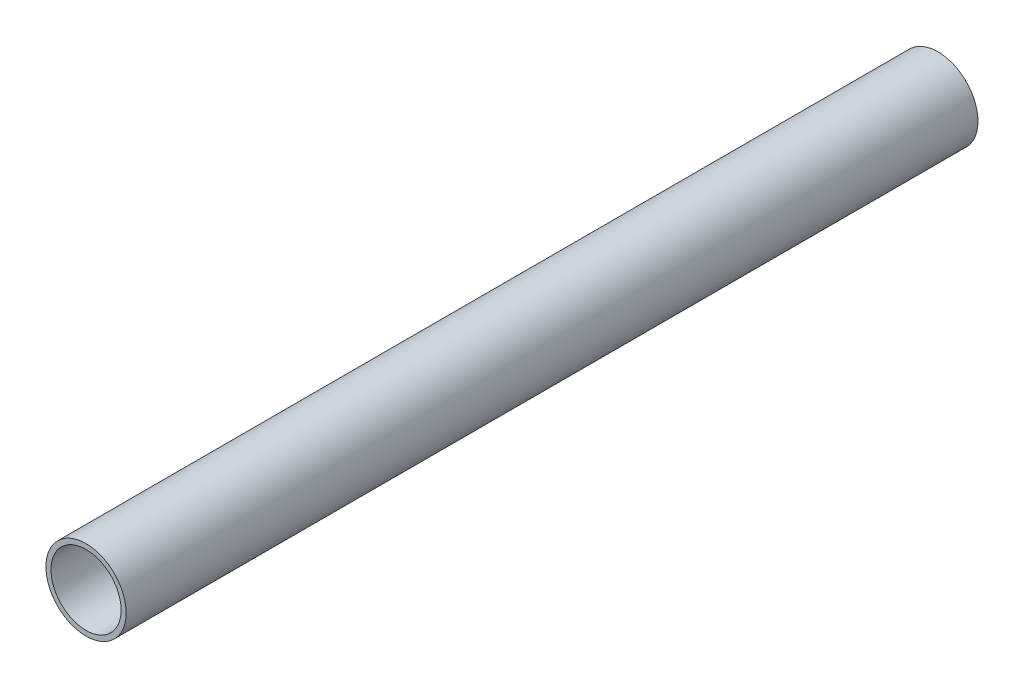
from build123d import *

# Parameters (mm, degrees)
SKETCH1_R           = 25.4
SKETCH1_R_2         = 22.225
BOSS_EXTRUDE1_DEPTH = 269.89405


with BuildPart() as part:
    # Sketch1 → Boss-Extrude1 (new, symmetric)
    with BuildSketch(Plane.XY):
        Circle(SKETCH1_R)
        Circle(SKETCH1_R_2, mode=Mode.SUBTRACT)
    extrude(amount=BOSS_EXTRUDE1_DEPTH, both=True)


solid = part.part
